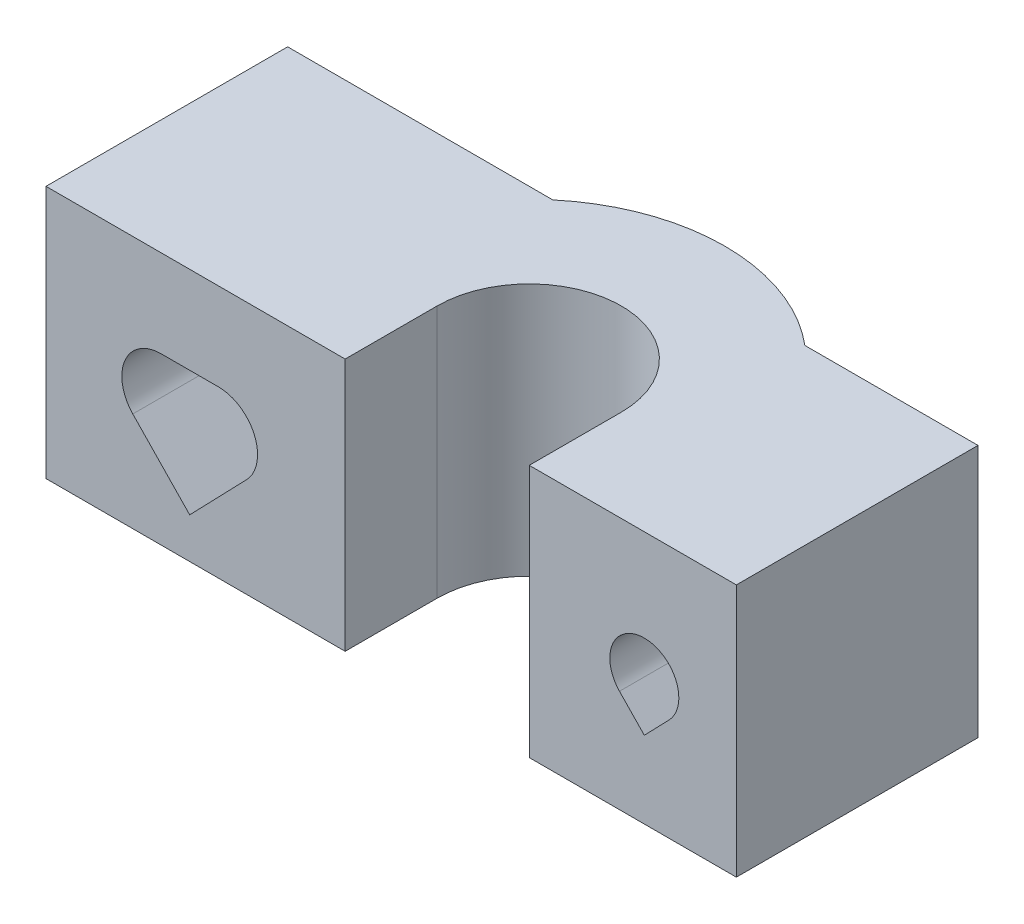
from build123d import *

# Parameters (mm, degrees)
BOSS_EXTRUDE1_DEPTH = 11
CUT_EXTRUDE1_DEPTH  = 44.327243162
CUT_EXTRUDE2_DEPTH  = 44.327243162
CUT_EXTRUDE3_DEPTH  = 43.793106922


with BuildPart() as part:
    # Sketch1 → Boss-Extrude1 (new body)
    with BuildSketch(Plane(origin=(0, 11, 0), x_dir=(-1, 0, 0), z_dir=(0, 1, 0))):
        with BuildLine():
            Line((-10, 0), (-40, 0))
            Line((-40, 0), (-40, -10.5))
            Line((-40, -10.5), (-32.477225575, -10.5))
            ThreePointArc((-32.477225575, -10.5), (-27, -12.5), (-21.522774425, -10.5))
            Line((-21.522774425, -10.5), (-10, -10.5))
            Line((-10, -10.5), (-10, 0))
        make_face()
    extrude(amount=-BOSS_EXTRUDE1_DEPTH)

    # Sketch2 → Cut-Extrude1 (cut, through all)
    with BuildSketch(Plane.XZ):
        with BuildLine():
            Line((31, 0), (23, 0))
            Line((23, 0), (23, -4))
            ThreePointArc((23, -4), (27, -8), (31, -4))
            Line((31, -4), (31, 0))
        make_face()
    extrude(amount=-CUT_EXTRUDE1_DEPTH, mode=Mode.SUBTRACT)

    # Sketch3 → Cut-Extrude2 (cut, through all)
    with BuildSketch(Plane.XY):
        with BuildLine():
            Line((34.920990299, 4.458012444), (36, 3.340665191))
            Line((36, 3.340665191), (37.079009701, 4.458012444))
            ThreePointArc((37.079009701, 4.458012444), (36, 7), (34.920990299, 4.458012444))
        make_face()
    extrude(amount=-CUT_EXTRUDE2_DEPTH, mode=Mode.SUBTRACT)

    # Sketch4 → Cut-Extrude3 (cut, through all)
    with BuildSketch(Plane(origin=(0, 0, -10.5), x_dir=(-1, 0, 0), z_dir=(0, 0, -1))):
        with BuildLine():
            Line((-16.244261233, 1.75834099), (-13.771383572, 4.31908077))
            ThreePointArc((-13.771383572, 4.31908077), (-13.429402982, 6.164242918), (-14.994261233, 7.2))
            Line((-14.994261233, 7.2), (-17.494261233, 7.2))
            ThreePointArc((-17.494261233, 7.2), (-19.059119484, 6.164242918), (-18.717138893, 4.31908077))
            Line((-18.717138893, 4.31908077), (-16.244261233, 1.75834099))
        make_face()
    extrude(amount=-CUT_EXTRUDE3_DEPTH, mode=Mode.SUBTRACT)


solid = part.part
